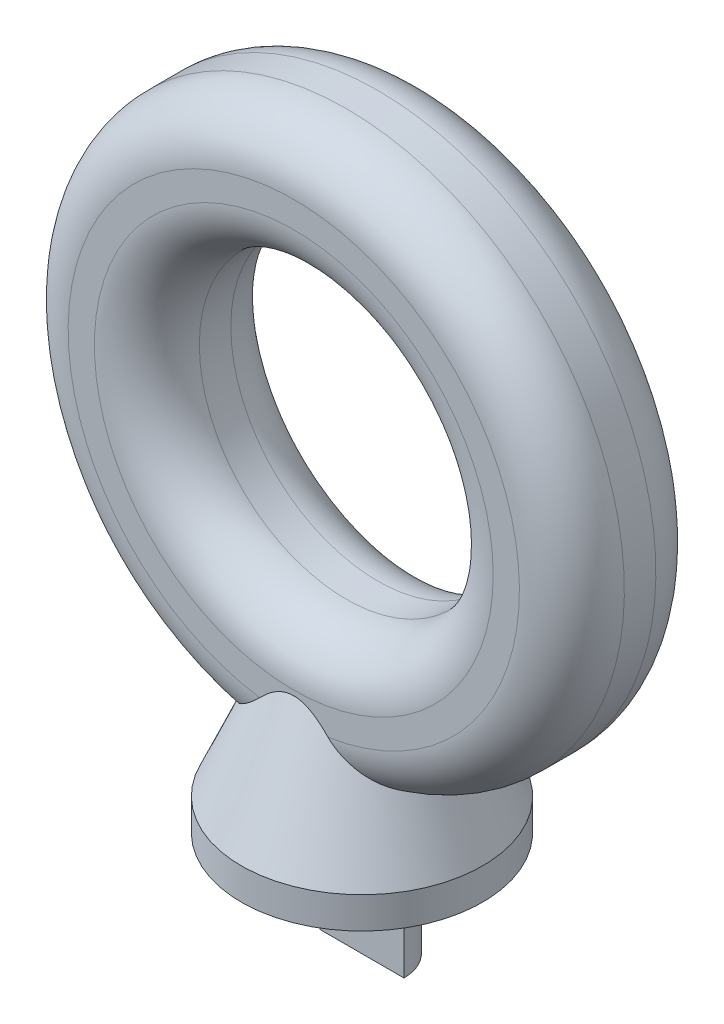
from build123d import *

# Parameters (mm, degrees)
ESBO_O2_R                = 26.5
ESBO_O2_R_2              = 14
RESSALTO_EXTRUS_O1_DEPTH = 6.5
FILETE1_R                = 5
ESBO_O4_W                = 9.767517643
ESBO_O4_H                = 5.903122081
CORTE_EXTRUS_O1_DEPTH    = 5


with BuildPart() as part:
    # Esboço2 → Ressalto-extrusão1 (new, symmetric)
    with BuildSketch(Plane.XY):
        with Locations(Location((0, 0, 0), (0, 0, 180))):
            Circle(ESBO_O2_R)
        with Locations(Location((0, 0, 0), (0, 0, 180))):
            Circle(ESBO_O2_R_2, mode=Mode.SUBTRACT)
    extrude(amount=RESSALTO_EXTRUS_O1_DEPTH, both=True)

    # Filete1
    filete1_edges = [part.edges().sort_by_distance(p)[0] for p in [
        (26.5, 0, -6.5),
        (26.5, 0, 6.5),
        (14, 0, -6.5),
        (14, 0, 6.5),
    ]]
    fillet(filete1_edges, radius=FILETE1_R)

    # Esboço3 → Revolução7 (revolve)
    with BuildSketch(Plane.XY, mode=Mode.PRIVATE) as revolu_o7_sk:
        Polygon((5, -16), (0, -16), (0, -44), (4, -44), (4, -34), (11.5, -34), (11.5, -31), align=None)
    revolve(revolu_o7_sk.sketch.rotate(Axis((0, 0, 0), (0, -1, 0)), 180), axis=Axis((0, 0, 0), (0, -1, 0)))

    # Esboço4 → Corte-extrusão1 (cut)
    with BuildSketch(Plane.XZ.offset(44)):
        with Locations((0.883758822, 2.951561041)):
            Rectangle(ESBO_O4_W, ESBO_O4_H)
    extrude(amount=-CORTE_EXTRUS_O1_DEPTH, mode=Mode.SUBTRACT)


solid = part.part
